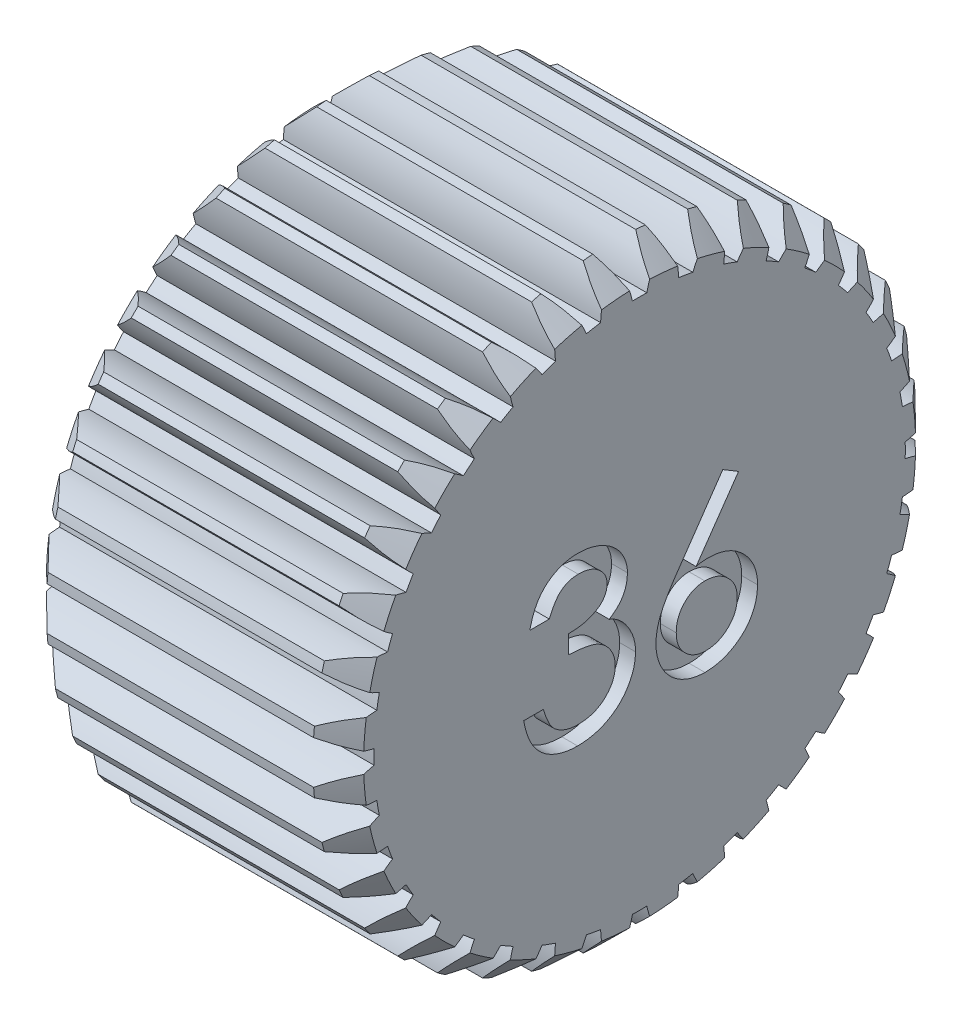
from build123d import *

# Parameters (mm, degrees)
BASPROSKE_W        = 10
BASPROSKE_H        = 9.5
TOOTHCUT_DEPTH     = 17.748134224
TEETHCUTS_COUNT    = 36
TEETHCUTS_ANGLE    = 350
BORSKE_R           = 2.5
BORE_DEPTH         = 0.5
CUT_EXTRUDE1_DEPTH = 0.5


with BuildPart() as part:
    # BasProSke → Base-Revolve (revolve)
    with BuildSketch(Plane(origin=(0, 0, 0), x_dir=(1, 0, 0), z_dir=(0, 1, 0)), mode=Mode.PRIVATE) as base_revolve_sk:
        with Locations((5, 4.75)):
            Rectangle(BASPROSKE_W, BASPROSKE_H)
    revolve(base_revolve_sk.sketch.rotate(Axis((-10, 0, 0), (1, 0, 0)), 180), axis=Axis((-10, 0, 0), (1, 0, 0)))

    # TooCutSke → ToothCut (cut, through all)
    with BuildSketch(Plane(origin=(0, 0, 0), x_dir=(0, 0, -1), z_dir=(1, 0, 0))):
        with BuildLine():
            ThreePointArc((0.227221176, 8.370916708), (0, 8.374), (-0.227221176, 8.370916708))
            ThreePointArc((-0.227221176, 8.370916708), (-0.411410437, 8.955426484), (-0.69207336, 9.500225241))
            ThreePointArc((-0.69207336, 9.500225241), (0, 9.5254), (0.69207336, 9.500225241))
            ThreePointArc((0.69207336, 9.500225241), (0.411410437, 8.955426484), (0.227221176, 8.370916708))
        make_face()
    toothcut = extrude(amount=TOOTHCUT_DEPTH, mode=Mode.SUBTRACT)

    # TeethCuts: ToothCut ×36 about axis
    teethcuts_axis = Axis((-10, 0, 0), (1, 0, 0))
    for i in range(1, TEETHCUTS_COUNT):
        add(toothcut.rotate(teethcuts_axis, i * TEETHCUTS_ANGLE / (TEETHCUTS_COUNT - 1)), mode=Mode.SUBTRACT)

    # BorSke → Bore (cut, symmetric)
    with BuildSketch(Plane(origin=(0, 0, 0), x_dir=(0, 0, -1), z_dir=(1, 0, 0))):
        Circle(BORSKE_R)
    extrude(amount=BORE_DEPTH, both=True, mode=Mode.SUBTRACT)

    # Sketch2 → Cut-Revolve1 (revolve, cut)
    with BuildSketch(Plane(origin=(0, 0, 0), x_dir=(1, 0, 0), z_dir=(0, 1, 0))):
        Polygon((0, 9.5), (0, 8.7), (0.8, 9.5), align=None)
        Polygon((9.2, 9.5), (10, 9.5), (10, 8.7), align=None)
    revolve(axis=Axis((0, 0, 0), (-1, 0, 0)), mode=Mode.SUBTRACT)

    # Sketch3 → Cut-Extrude1 (cut)
    # profile 1 of 2: a face of its own
    with BuildSketch(Plane(origin=(10, 0, 0), x_dir=(0, 0, -1), z_dir=(1, 0, 0))):
        with BuildLine():
            Line((-2.846554487, 1.000997153), (-3.461538462, 1.000997153))
            add(Edge.make_bspline(
                [(-3.461538462, 1.000997153), (-3.449000564, 1.056301475), (-3.424457842, 1.164558744), (-3.374845817, 1.319208229), (-3.318944584, 1.463836172), (-3.254360886, 1.597337288), (-3.179521597, 1.718670634), (-3.098504714, 1.830177798), (-3.0078309, 1.929533383), (-2.909491068, 2.018111809), (-2.803981686, 2.094630526), (-2.694424945, 2.162510765), (-2.579948276, 2.219423773), (-2.461272088, 2.267108315), (-2.337786813, 2.3032007), (-2.209594956, 2.327579024), (-2.077449276, 2.344704443), (-1.987569393, 2.346329189), (-1.942107372, 2.347150999)],
                knots=[0, 0, 0, 0, 1.225194122, 2.398296627, 3.506547767, 4.574817873, 5.598350885, 6.584148364, 7.54966307, 8.500147383, 9.439776218, 10.36307994, 11.282851771, 12.199447467, 13.124300948, 14.058371117, 15.017907346, 16, 16, 16, 16], degree=3))
            add(Edge.make_bspline(
                [(-1.942107372, 2.347150999), (-1.871526777, 2.344774174), (-1.731821771, 2.340069562), (-1.5260175, 2.304520716), (-1.328295428, 2.243499872), (-1.14049506, 2.161012516), (-0.966948146, 2.060013998), (-0.81345859, 1.942185944), (-0.681454852, 1.810457045), (-0.574752706, 1.6646715), (-0.490257787, 1.511693338), (-0.429887057, 1.354648565), (-0.39149621, 1.19514142), (-0.386906018, 1.087677517), (-0.384615385, 1.034050037)],
                knots=[0, 0, 0, 0, 1.126551995, 2.229861531, 3.322496069, 4.422827045, 5.497949776, 6.520418829, 7.504194933, 8.464779191, 9.395175895, 10.286118409, 11.144725379, 12, 12, 12, 12], degree=3))
            add(Edge.make_bspline(
                [(-0.384615385, 1.034050037), (-0.386253567, 0.982174362), (-0.389458338, 0.880690169), (-0.417324446, 0.733162597), (-0.462131748, 0.594767313), (-0.526229321, 0.466078818), (-0.607915069, 0.346839426), (-0.708695296, 0.238078944), (-0.826579918, 0.137815386), (-0.915706223, 0.081459783), (-0.961538462, 0.052479524)],
                knots=[0, 0, 0, 0, 1.039530957, 2.033630564, 2.999111873, 3.948297759, 4.906578666, 5.887513816, 6.913676835, 8, 8, 8, 8], degree=3))
            add(Edge.make_bspline(
                [(-0.961538462, 0.052479524), (-0.912014874, 0.031261023), (-0.81319733, -0.011077592), (-0.678693284, -0.1013393), (-0.555046931, -0.209060446), (-0.485905511, -0.294610944), (-0.450721154, -0.338145476)],
                knots=[0, 0, 0, 0, 0.990740455, 1.976887035, 2.970487876, 4, 4, 4, 4], degree=3))
            add(Edge.make_bspline(
                [(-0.450721154, -0.338145476), (-0.425226022, -0.373553338), (-0.374868522, -0.443490277), (-0.308066503, -0.552724421), (-0.253766131, -0.665366135), (-0.206580759, -0.778573416), (-0.171734674, -0.89446441), (-0.14662554, -1.012026878), (-0.131056851, -1.131664681), (-0.129158752, -1.21216466), (-0.128205128, -1.252608617)],
                knots=[0, 0, 0, 0, 1.060434252, 2.094549648, 3.107169572, 4.097295716, 5.072846837, 6.043796276, 7.017184609, 8, 8, 8, 8], degree=3))
            add(Edge.make_bspline(
                [(-0.128205128, -1.252608617), (-0.130720906, -1.322299527), (-0.13576692, -1.46208189), (-0.182810147, -1.669053234), (-0.254847237, -1.872938201), (-0.339181917, -2.036347786), (-0.418583523, -2.163059109), (-0.485544125, -2.253496215), (-0.557629891, -2.339336779), (-0.63673562, -2.418545313), (-0.720349085, -2.493969714), (-0.811143073, -2.563074771), (-0.907514943, -2.627240532), (-1.008999027, -2.686238457), (-1.115721565, -2.738045765), (-1.225367698, -2.784638546), (-1.339260877, -2.822001794), (-1.455274474, -2.854921466), (-1.575343069, -2.878192483), (-1.698219689, -2.896890484), (-1.824770926, -2.906430878), (-1.910043691, -2.908309928), (-1.953125, -2.909259258)],
                knots=[0, 0, 0, 0, 1.521749033, 3.052244174, 4.617626532, 6.240122497, 7.060311358, 7.885196768, 8.698339091, 9.508724546, 10.330730427, 11.158549718, 12.000758621, 12.860902525, 13.722748307, 14.593084173, 15.463328201, 16.341708233, 17.227848997, 18.135261118, 19.057900949, 20, 20, 20, 20], degree=3))
            add(Edge.make_bspline(
                [(-1.953125, -2.909259258), (-2.00758703, -2.908043453), (-2.114777268, -2.905650548), (-2.271939228, -2.888649089), (-2.422417312, -2.859599464), (-2.565730269, -2.818344883), (-2.702812259, -2.766483994), (-2.832313686, -2.70187046), (-2.955296694, -2.626545605), (-3.071146933, -2.53915164), (-3.178292057, -2.438854568), (-3.27658942, -2.32581164), (-3.363406338, -2.198521385), (-3.441883664, -2.058936506), (-3.509875831, -1.905463186), (-3.568526901, -1.739336737), (-3.618268012, -1.560014885), (-3.641754309, -1.435106435), (-3.653846154, -1.370797719)],
                knots=[0, 0, 0, 0, 1.031951552, 2.031050468, 2.99141865, 3.932589319, 4.853771667, 5.764839348, 6.670884665, 7.583203617, 8.509779947, 9.447179227, 10.415909331, 11.424319639, 12.477825485, 13.592421652, 14.760465984, 16, 16, 16, 16], degree=3))
            Line((-3.653846154, -1.370797719), (-3.031850962, -1.370797719))
            add(Edge.make_bspline(
                [(-3.031850962, -1.370797719), (-3.019453706, -1.413286141), (-2.995700076, -1.494695631), (-2.956759054, -1.610962883), (-2.914868141, -1.715442587), (-2.871704267, -1.809538163), (-2.827050256, -1.89287078), (-2.779938367, -1.965306002), (-2.731336618, -2.027521127), (-2.694745347, -2.061644933), (-2.677283654, -2.077929129)],
                knots=[0, 0, 0, 0, 1.326285875, 2.54121601, 3.672658499, 4.697761427, 5.642367002, 6.502616728, 7.285434817, 8, 8, 8, 8], degree=3))
            add(Edge.make_bspline(
                [(-2.677283654, -2.077929129), (-2.652007401, -2.098561624), (-2.601946418, -2.139425391), (-2.51950962, -2.189955385), (-2.434498023, -2.235191209), (-2.343874728, -2.269229935), (-2.250389501, -2.298000852), (-2.152454044, -2.317841174), (-2.050594545, -2.330084981), (-1.981204831, -2.33158009), (-1.946113782, -2.332336181)],
                knots=[0, 0, 0, 0, 0.989076215, 1.958918776, 2.928708407, 3.907140108, 4.891221483, 5.894723991, 6.935341563, 8, 8, 8, 8], degree=3))
            add(Edge.make_bspline(
                [(-1.946113782, -2.332336181), (-1.902677211, -2.331310709), (-1.817576407, -2.329301608), (-1.693495187, -2.31549863), (-1.57584084, -2.291218473), (-1.465130753, -2.257463524), (-1.360631242, -2.214112131), (-1.263436611, -2.160818062), (-1.172395019, -2.098557422), (-1.089747184, -2.026310834), (-1.015697742, -1.947902026), (-0.949664913, -1.866093608), (-0.893237924, -1.781288348), (-0.848033718, -1.692394606), (-0.812416851, -1.600507428), (-0.787757436, -1.505371429), (-0.77194983, -1.407048232), (-0.770146086, -1.340476988), (-0.769230769, -1.306695155)],
                knots=[0, 0, 0, 0, 1.196856166, 2.344877135, 3.434653565, 4.502660904, 5.529498559, 6.546397239, 7.551828815, 8.562675341, 9.564818567, 10.520268272, 11.456705045, 12.365995596, 13.262962725, 14.166698094, 15.069683942, 16, 16, 16, 16], degree=3))
            add(Edge.make_bspline(
                [(-0.769230769, -1.306695155), (-0.771223014, -1.262133156), (-0.775204814, -1.17306932), (-0.805426877, -1.042106129), (-0.853898758, -0.915097569), (-0.922369119, -0.795016165), (-1.005709193, -0.682521418), (-1.105669734, -0.58398346), (-1.219640245, -0.499793075), (-1.325947356, -0.441586603), (-1.422272627, -0.403120897), (-1.506268689, -0.376356587), (-1.601654995, -0.352584302), (-1.707985447, -0.331758116), (-1.825618394, -0.313839749), (-1.954591804, -0.299047646), (-2.095244234, -0.287245974), (-2.19282883, -0.281196235), (-2.243589744, -0.278049322)],
                knots=[0, 0, 0, 0, 1.058801672, 2.116173898, 3.179133807, 4.280986043, 5.392377071, 6.498225676, 7.604871823, 8.752253925, 9.368447799, 10.068883315, 10.846735517, 11.704571958, 12.644304815, 13.675272135, 14.790738352, 16, 16, 16, 16], degree=3))
            Line((-2.243589744, -0.278049322), (-2.243589744, 0.295868948))
            add(Edge.make_bspline(
                [(-2.243589744, 0.295868948), (-2.177421702, 0.29708638), (-2.05039898, 0.299423483), (-1.868038334, 0.320665044), (-1.702072516, 0.354866446), (-1.553307129, 0.403731731), (-1.423542836, 0.464209871), (-1.310978302, 0.529102341), (-1.219051018, 0.603104385), (-1.146638569, 0.683812908), (-1.093410411, 0.770783709), (-1.053058999, 0.859907432), (-1.030710485, 0.954182), (-1.027341075, 1.017917625), (-1.025641026, 1.050075678)],
                knots=[0, 0, 0, 0, 1.49683591, 2.87347434, 4.147795521, 5.325633569, 6.407353164, 7.383009189, 8.25851615, 9.066624807, 9.823413814, 10.557538392, 11.272200497, 12, 12, 12, 12], degree=3))
            add(Edge.make_bspline(
                [(-1.025641026, 1.050075678), (-1.026369875, 1.073836461), (-1.027806442, 1.120669092), (-1.04055643, 1.189882956), (-1.06030953, 1.256871325), (-1.088559185, 1.321503268), (-1.125564584, 1.383194669), (-1.169307563, 1.443350986), (-1.222178195, 1.500596358), (-1.281853887, 1.555149106), (-1.347166154, 1.605941459), (-1.417829739, 1.650471037), (-1.493125583, 1.687461059), (-1.573059385, 1.717532589), (-1.657074816, 1.741670621), (-1.74589776, 1.758601972), (-1.839034096, 1.768790523), (-1.90268468, 1.769742942), (-1.935096154, 1.770227922)],
                knots=[0, 0, 0, 0, 0.88508993, 1.744517034, 2.61478088, 3.484243336, 4.365825862, 5.291885516, 6.252189795, 7.265246754, 8.303377192, 9.332440159, 10.373327524, 11.425096702, 12.51242353, 13.62794981, 14.792129802, 16, 16, 16, 16], degree=3))
            add(Edge.make_bspline(
                [(-1.935096154, 1.770227922), (-1.981635813, 1.768214563), (-2.072585155, 1.764279991), (-2.204769899, 1.736022764), (-2.327492041, 1.68684725), (-2.42318475, 1.630814152), (-2.495075886, 1.573996683), (-2.547866738, 1.52065104), (-2.599177264, 1.457281541), (-2.651485508, 1.385558467), (-2.701647242, 1.303140927), (-2.751238379, 1.211454043), (-2.800640052, 1.109968115), (-2.830874745, 1.038210648), (-2.846554487, 1.000997153)],
                knots=[0, 0, 0, 0, 1.30644707, 2.553102055, 3.773430717, 5.004978473, 5.652102429, 6.34150733, 7.107309491, 7.939915375, 8.832283585, 9.813897121, 10.866284818, 12, 12, 12, 12], degree=3))
        make_face()
    # profile 2 of 2: a face of its own
    with BuildSketch(Plane(origin=(10, 0, 0), x_dir=(0, 0, -1), z_dir=(1, 0, 0))):
        with BuildLine():
            Line((2.62119391, 2.347150999), (3.118990385, 2.048673435))
            Line((3.118990385, 2.048673435), (1.778846154, 0.121590101))
            add(Edge.make_bspline(
                [(1.778846154, 0.121590101), (1.803103927, 0.128735077), (1.85565553, 0.144213824), (1.943287263, 0.158604475), (2.044808553, 0.165856318), (2.117041489, 0.16703637), (2.155448718, 0.167663819)],
                knots=[0, 0, 0, 0, 0.796048766, 1.724545677, 2.790110166, 4, 4, 4, 4], degree=3))
            add(Edge.make_bspline(
                [(2.155448718, 0.167663819), (2.210270751, 0.166361304), (2.317994089, 0.163801909), (2.475677074, 0.142358042), (2.626267543, 0.107153382), (2.77006469, 0.058169792), (2.906638673, -0.005583495), (3.03704025, -0.081463219), (3.158700692, -0.174019501), (3.272478444, -0.278420646), (3.37749416, -0.391155584), (3.467694049, -0.512375587), (3.545408216, -0.637738157), (3.60943692, -0.768648437), (3.657024529, -0.905796437), (3.692410746, -1.047504832), (3.714077963, -1.194850796), (3.716645163, -1.294936725), (3.717948718, -1.345757655)],
                knots=[0, 0, 0, 0, 1.085768624, 2.13349656, 3.1458852, 4.145750037, 5.137155722, 6.127501693, 7.128940571, 8.158980511, 9.184145427, 10.176323106, 11.147419034, 12.102959344, 13.056918676, 14.017869493, 14.993527694, 16, 16, 16, 16], degree=3))
            add(Edge.make_bspline(
                [(3.717948718, -1.345757655), (3.715492477, -1.415056746), (3.710660243, -1.551390827), (3.670912093, -1.751031893), (3.608010585, -1.941999087), (3.518262982, -2.122434218), (3.404912487, -2.291222295), (3.26524222, -2.443071952), (3.101890267, -2.578278972), (2.918072274, -2.695428445), (2.717859038, -2.790165434), (2.506546174, -2.85872068), (2.286357165, -2.901264102), (2.136274673, -2.906572114), (2.060296474, -2.909259258)],
                knots=[0, 0, 0, 0, 0.981999396, 1.931915476, 2.875165147, 3.825883243, 4.780566088, 5.74908454, 6.740839944, 7.779754303, 8.832355466, 9.872951476, 10.923196738, 12, 12, 12, 12], degree=3))
            add(Edge.make_bspline(
                [(2.060296474, -2.909259258), (1.991342695, -2.90673683), (1.854709294, -2.901738584), (1.654000012, -2.862340083), (1.46115052, -2.798882817), (1.277806214, -2.711098553), (1.108788237, -2.598963331), (0.957026292, -2.465626751), (0.824478488, -2.311652053), (0.713047283, -2.138903713), (0.624623519, -1.952423748), (0.559599884, -1.757530559), (0.520463828, -1.555654426), (0.515379989, -1.418709479), (0.512820513, -1.349764065)],
                knots=[0, 0, 0, 0, 1.013919762, 2.009103873, 2.997048414, 3.994509061, 4.990420291, 5.971920342, 6.957603089, 7.969950955, 8.9872563, 9.986070715, 10.986080238, 12, 12, 12, 12], degree=3))
            add(Edge.make_bspline(
                [(0.512820513, -1.349764065), (0.514489237, -1.296935995), (0.517873435, -1.189799835), (0.541898898, -1.027821734), (0.58115632, -0.86296738), (0.627359244, -0.724446291), (0.672190708, -0.609974646), (0.713671539, -0.519563351), (0.759606476, -0.424145773), (0.811667345, -0.324704872), (0.87124761, -0.222148639), (0.935273609, -0.114164001), (1.006448801, -0.002736259), (1.056265173, 0.072906372), (1.081730769, 0.111574076)],
                knots=[0, 0, 0, 0, 1.194305989, 2.422071347, 3.694670561, 5.022004315, 5.720134447, 6.47362152, 7.270449589, 8.114647718, 9.010750929, 9.951985565, 10.953076949, 12, 12, 12, 12], degree=3))
            Line((1.081730769, 0.111574076), (2.62119391, 2.347150999))
        make_face()
        with BuildLine():
            add(Edge.make_bspline(
                [(2.056290064, -0.409259258), (2.025522546, -0.409916921), (1.964703345, -0.411216946), (1.875528229, -0.424909568), (1.789453264, -0.44565522), (1.707328029, -0.475976149), (1.628779804, -0.51416957), (1.553848252, -0.560728409), (1.482576699, -0.616314494), (1.415170943, -0.679411944), (1.354594541, -0.7498038), (1.29935644, -0.823854956), (1.254554684, -0.904225969), (1.218697301, -0.989161303), (1.188985467, -1.078059374), (1.168196922, -1.172008374), (1.156059915, -1.27098404), (1.154594592, -1.338378217), (1.153846154, -1.372800924)],
                knots=[0, 0, 0, 0, 1.000668136, 1.978054791, 2.929484158, 3.878303629, 4.821130496, 5.767956646, 6.743892455, 7.758622191, 8.767575263, 9.763037712, 10.760455477, 11.753542685, 12.760386935, 13.807023548, 14.879900473, 16, 16, 16, 16], degree=3))
            add(Edge.make_bspline(
                [(1.153846154, -1.372800924), (1.154497578, -1.406901199), (1.155773552, -1.473694976), (1.169296008, -1.571634824), (1.190941531, -1.665058907), (1.222644979, -1.753695045), (1.261342746, -1.838362364), (1.310131397, -1.918059413), (1.367282776, -1.993132032), (1.432083293, -2.062847703), (1.502956223, -2.125809572), (1.57813841, -2.180451824), (1.654871849, -2.228381366), (1.735671975, -2.265383829), (1.818184782, -2.295862129), (1.904261114, -2.316571902), (1.992738885, -2.330395892), (2.052897633, -2.33168433), (2.083333333, -2.332336181)],
                knots=[0, 0, 0, 0, 1.099969797, 2.154561419, 3.184363179, 4.189745603, 5.187708984, 6.183808971, 7.198903794, 8.22825443, 9.251098181, 10.253299465, 11.225387826, 12.165412448, 13.116428293, 14.059905273, 15.018461259, 16, 16, 16, 16], degree=3))
            add(Edge.make_bspline(
                [(2.083333333, -2.332336181), (2.117111459, -2.331780214), (2.183640432, -2.330685188), (2.281436922, -2.315588375), (2.375590736, -2.293737881), (2.466469058, -2.264343779), (2.551986896, -2.223053324), (2.634707143, -2.174955585), (2.713958403, -2.118052311), (2.78728628, -2.05179097), (2.855223894, -1.980589009), (2.914337382, -1.904226812), (2.964998953, -1.824605354), (3.006400833, -1.741469403), (3.037215914, -1.654153259), (3.060935125, -1.563842993), (3.073539863, -1.469306449), (3.075786626, -1.405217979), (3.076923077, -1.372800924)],
                knots=[0, 0, 0, 0, 1.054506433, 2.076942642, 3.08409574, 4.073807639, 5.053850104, 6.045100359, 7.061397357, 8.095844899, 9.129029121, 10.132772442, 11.10813953, 12.073918953, 13.02762105, 13.996719216, 14.986705996, 16, 16, 16, 16], degree=3))
            add(Edge.make_bspline(
                [(3.076923077, -1.372800924), (3.075928027, -1.340029052), (3.073969268, -1.275517492), (3.059411198, -1.180571761), (3.036536059, -1.089248973), (3.004436048, -1.001395767), (2.962144979, -0.917622851), (2.909101208, -0.838701038), (2.849261944, -0.761613983), (2.779149565, -0.69084547), (2.703966103, -0.624392096), (2.622328597, -0.567832134), (2.538035662, -0.518038085), (2.449578068, -0.4775507), (2.356565294, -0.447806287), (2.260061804, -0.425910486), (2.159586187, -0.410925995), (2.091067579, -0.409820411), (2.056290064, -0.409259258)],
                knots=[0, 0, 0, 0, 1.007406841, 1.98308429, 2.946696416, 3.898367138, 4.853354566, 5.824321577, 6.818405618, 7.849339281, 8.882723662, 9.899554728, 10.89792352, 11.890309722, 12.883757414, 13.89487152, 14.931514512, 16, 16, 16, 16], degree=3))
        make_face(mode=Mode.SUBTRACT)
    extrude(amount=-CUT_EXTRUDE1_DEPTH, mode=Mode.SUBTRACT)


solid = part.part
